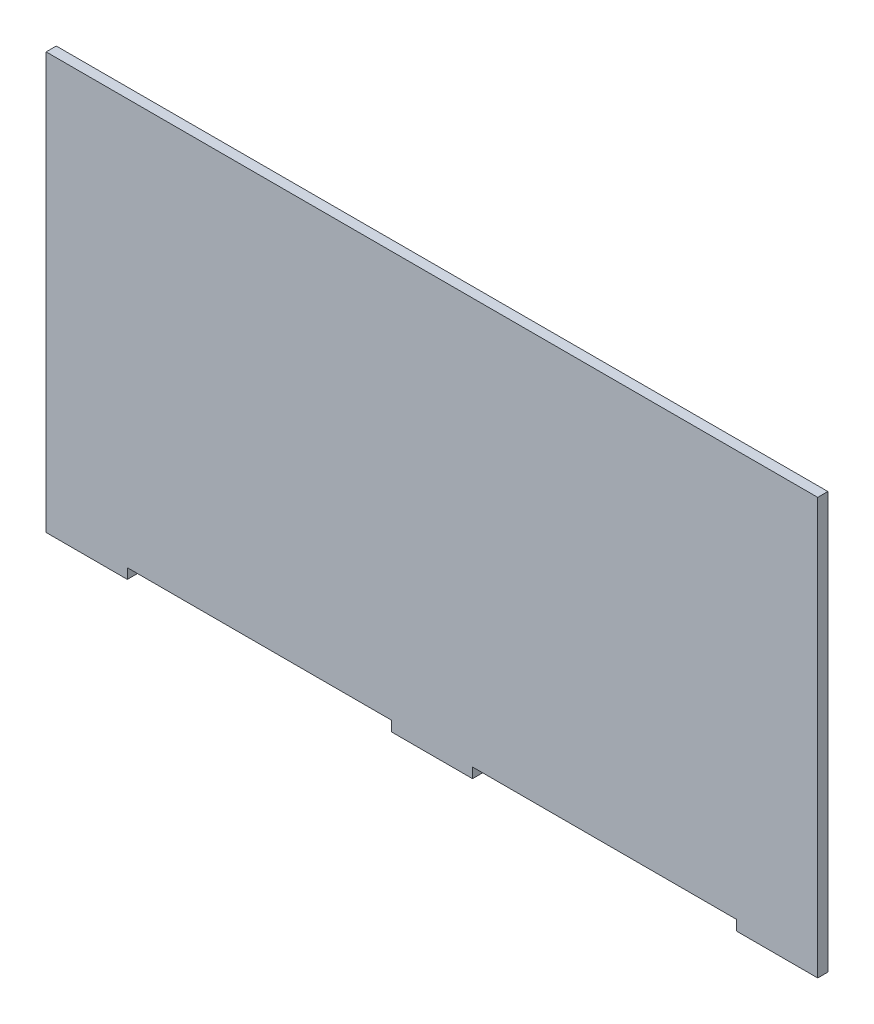
from build123d import *

# Parameters (mm, degrees)
BOSS_EXTRU_1_DEPTH = 5


with BuildPart() as part:
    # Esquisse1 → Boss.-Extru.1 (new body)
    with BuildSketch(Plane.XY):
        Polygon((-39.474626595, -50.570003164), (0.525373405, -50.570003164), (0.525373405, -45.570003164), (130.525373405, -45.570003164), (130.525373405, -50.570003164), (170.525373405, -50.570003164), (170.525373405, -45.570003164), (300.525373405, -45.570003164), (300.525373405, -50.570003164), (340.525373405, -50.570003164), (340.525373405, 154.429996836), (-39.474626595, 154.429996836), align=None)
    extrude(amount=BOSS_EXTRU_1_DEPTH)


solid = part.part
